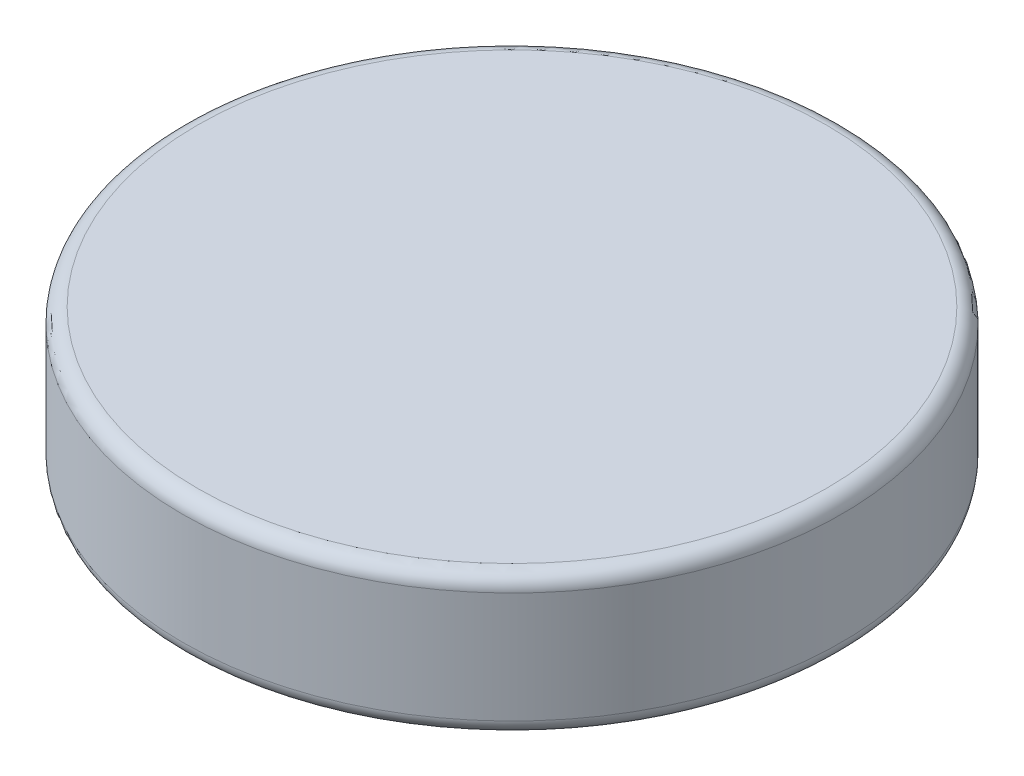
from build123d import *

# Parameters (mm, degrees)
SKETCH1_R           = 11
BOSS_EXTRUDE1_DEPTH = 2.35
FILLET1_R           = 0.5


with BuildPart() as part:
    # Sketch1 → Boss-Extrude1 (new, symmetric)
    with BuildSketch(Plane(origin=(0, 0, 0), x_dir=(1, 0, 0), z_dir=(0, 1, 0))):
        with Locations(Location((0, 0, 0), (0, 0, 270))):
            Circle(SKETCH1_R)
    extrude(amount=BOSS_EXTRUDE1_DEPTH, both=True)

    # Fillet1
    fillet1_edges = [part.edges().sort_by_distance(p)[0] for p in [
        (0, -2.35, -11),
        (0, 2.35, -11),
    ]]
    fillet(fillet1_edges, radius=FILLET1_R)


solid = part.part
